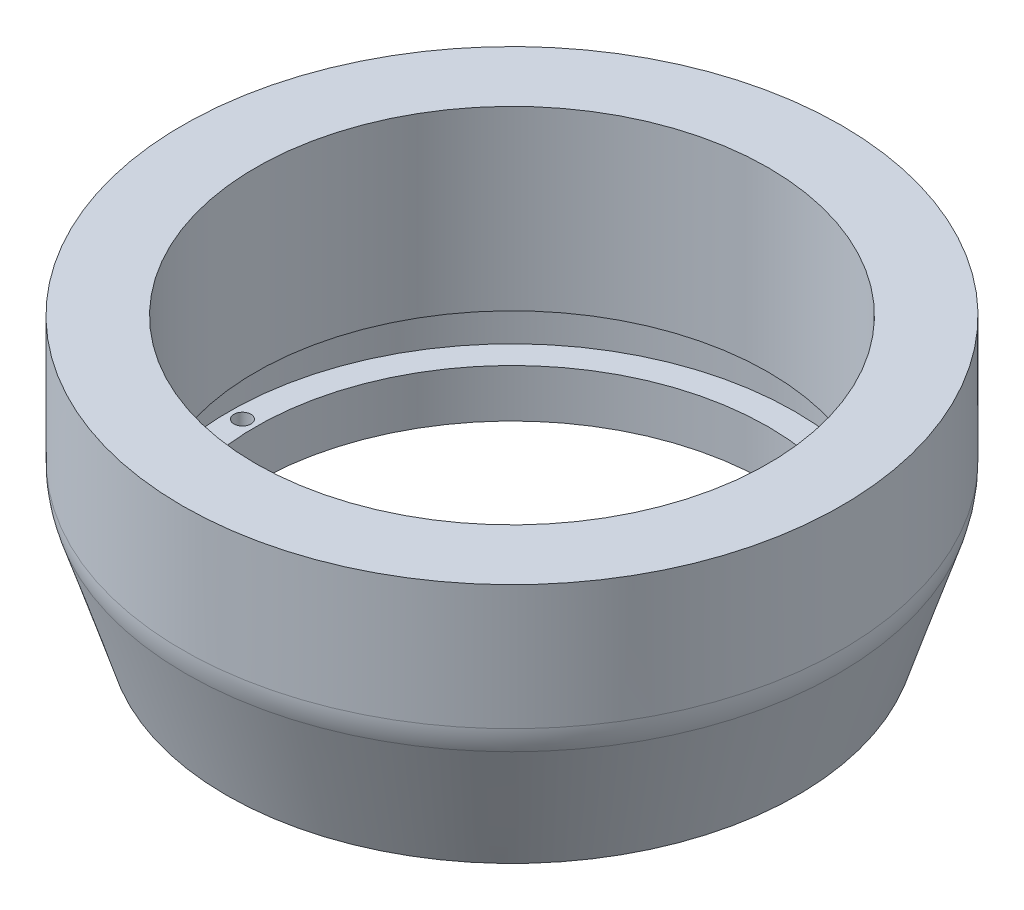
from build123d import *

# Parameters (mm, degrees)
SKETCH1_R               = 45
SKETCH1_R_2             = 35
BOSS_EXTRUDE1_DEPTH     = 37.21
FILLET1_R               = 10
SKETCH3_W               = 3.623403209
SKETCH3_H               = 6.465591727
CUT_EXTRUDE3_DEPTH      = 74.719632638
CUT_EXTRUDE3_DEPTH_BACK = 10
SKETCH4_R               = 1.161936473
SKETCH5_R               = 1.222255242
CUT_EXTRUDE4_DEPTH      = 10


with BuildPart() as part:
    # Sketch1 → Boss-Extrude1 (new body)
    with BuildSketch(Plane(origin=(0, 0, 0), x_dir=(1, 0, 0), z_dir=(0, 1, 0))):
        with Locations(Location((0, 0, 0), (0, 0, 270))):
            Circle(SKETCH1_R)
        with Locations(Location((0, 0, 0), (0, 0, 270))):
            Circle(SKETCH1_R_2, mode=Mode.SUBTRACT)
    extrude(amount=BOSS_EXTRUDE1_DEPTH)

    # Sketch2 → Cut-Revolve2 (revolve, cut)
    with BuildSketch(Plane(origin=(0, 0, 0), x_dir=(0, 0, -1), z_dir=(1, 0, 0)), mode=Mode.PRIVATE) as cut_revolve2_sk:
        Polygon((45, 18.605), (39.004948157, 0), (45, 0), align=None)
    revolve(cut_revolve2_sk.sketch.rotate(Axis((0, 37.21, 0), (0, -1, 0)), 180), axis=Axis((0, 37.21, 0), (0, -1, 0)), mode=Mode.SUBTRACT)

    # Fillet1
    fillet1_edges = [part.edges().sort_by_distance(p)[0] for p in [
        (0, 18.605, -45),
    ]]
    fillet(fillet1_edges, radius=FILLET1_R)

    # Sketch3 → Cut-Revolve3 (revolve, cut)
    with BuildSketch(Plane(origin=(0, 0, 0), x_dir=(0, 0, -1), z_dir=(1, 0, 0))):
        with Locations((-36.811701605, 9.799884952)):
            Rectangle(SKETCH3_W, SKETCH3_H)
    revolve(axis=Axis((0, 37.21, 0), (0, -1, 0)), mode=Mode.SUBTRACT)

    # Sketch4 → Cut-Extrude3 (cut, two sides: drawn at the far end of the back side and taken through both)
    with BuildSketch(Plane(origin=(0, 0, 0), x_dir=(-1, 0, 0), z_dir=(0, -1, 0)).offset(-CUT_EXTRUDE3_DEPTH_BACK)):
        with Locations(Location((36.80548689, 0, 0), (0, 0, 270))):
            Circle(SKETCH4_R)
    extrude(amount=CUT_EXTRUDE3_DEPTH + CUT_EXTRUDE3_DEPTH_BACK, mode=Mode.SUBTRACT)

    # Sketch5 → Cut-Extrude4 (cut)
    with BuildSketch(Plane(origin=(0, 0, 0), x_dir=(-1, 0, 0), z_dir=(0, -1, 0))):
        with Locations(Location((-36.771801863, 0, 0), (0, 0, 90))):
            Circle(SKETCH5_R)
    extrude(amount=-CUT_EXTRUDE4_DEPTH, mode=Mode.SUBTRACT)


solid = part.part
